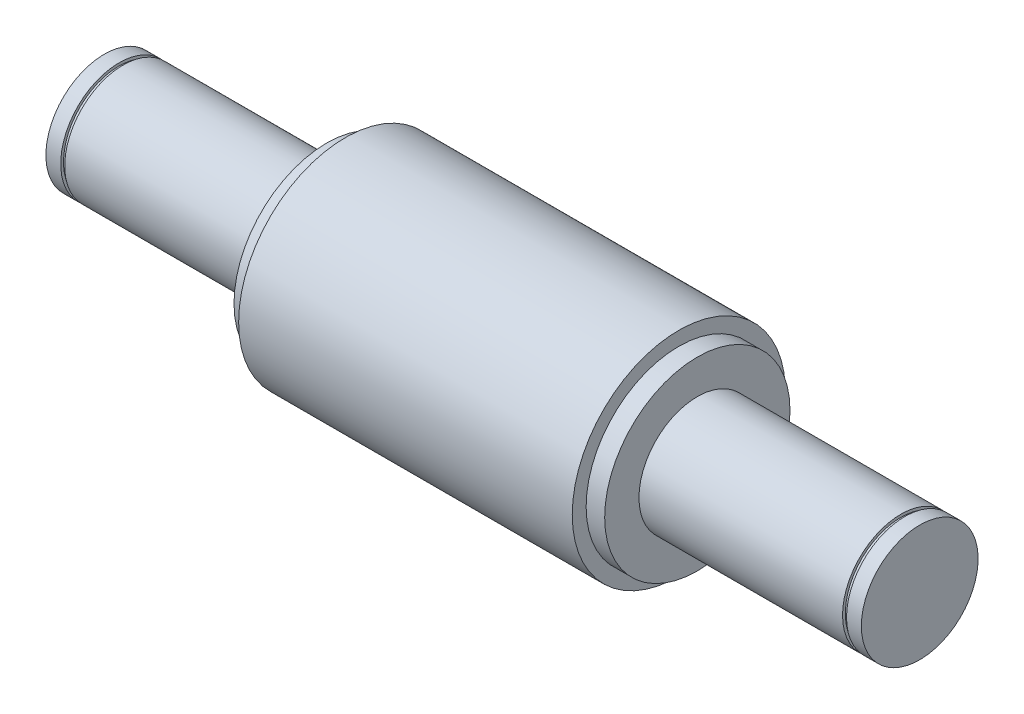
from build123d import *

# Parameters (mm, degrees)
IZIM1_R                     = 50
Y_KSEKLIK_EKSTR_ZYON1_DEPTH = 100
IZIM1_3_R                   = 57.5
IZIM1_3_R_2                 = 50
Y_KSEKLIK_EKSTR_ZYON2_DEPTH = 90
IZIM11_R                    = 31.5
Y_KSEKLIK_EKSTR_ZYON7_DEPTH = 120
IZIM12_W                    = 2.15
IZIM12_H                    = 5.230498787


with BuildPart() as part:
    # Çizim1 → Yükseklik-Ekstrüzyon1 (new, symmetric)
    with BuildSketch(Plane(origin=(0, 0, 0), x_dir=(0, 0, -1), z_dir=(1, 0, 0))):
        Circle(IZIM1_R)
    extrude(amount=Y_KSEKLIK_EKSTR_ZYON1_DEPTH, both=True)

    # Çizim1<3> → Yükseklik-Ekstrüzyon2 (add, symmetric)
    with BuildSketch(Plane(origin=(0, 0, 0), x_dir=(0, 0, -1), z_dir=(1, 0, 0))):
        Circle(IZIM1_3_R)
        Circle(IZIM1_3_R_2, mode=Mode.SUBTRACT)
    extrude(amount=Y_KSEKLIK_EKSTR_ZYON2_DEPTH, both=True)

    # Çizim11 → Yükseklik-Ekstrüzyon7 (add)
    with BuildSketch(Plane(origin=(100, 0, 0), x_dir=(0, 0, -1), z_dir=(1, 0, 0))):
        Circle(IZIM11_R)
    y_kseklik_ekstr_zyon7 = extrude(amount=Y_KSEKLIK_EKSTR_ZYON7_DEPTH)

    # Çizim12 → Kes-Döndür1 (revolve, cut)
    with BuildSketch(Plane.XY):
        with Locations((210.925, 32.615249394)):
            Rectangle(IZIM12_W, IZIM12_H)
    kes_d_nd_r1 = revolve(axis=Axis((220, 0, 0), (-1, 0, 0)), mode=Mode.SUBTRACT)

    # Aynalama6: Yükseklik-Ekstrüzyon7, Kes-Döndür1 across plane
    add(y_kseklik_ekstr_zyon7.mirror(Plane(origin=(0, 0, 0), x_dir=(0, 0, 1), z_dir=(1, 0, 0))))
    add(kes_d_nd_r1.mirror(Plane(origin=(0, 0, 0), x_dir=(0, 0, 1), z_dir=(1, 0, 0))), mode=Mode.SUBTRACT)


solid = part.part
